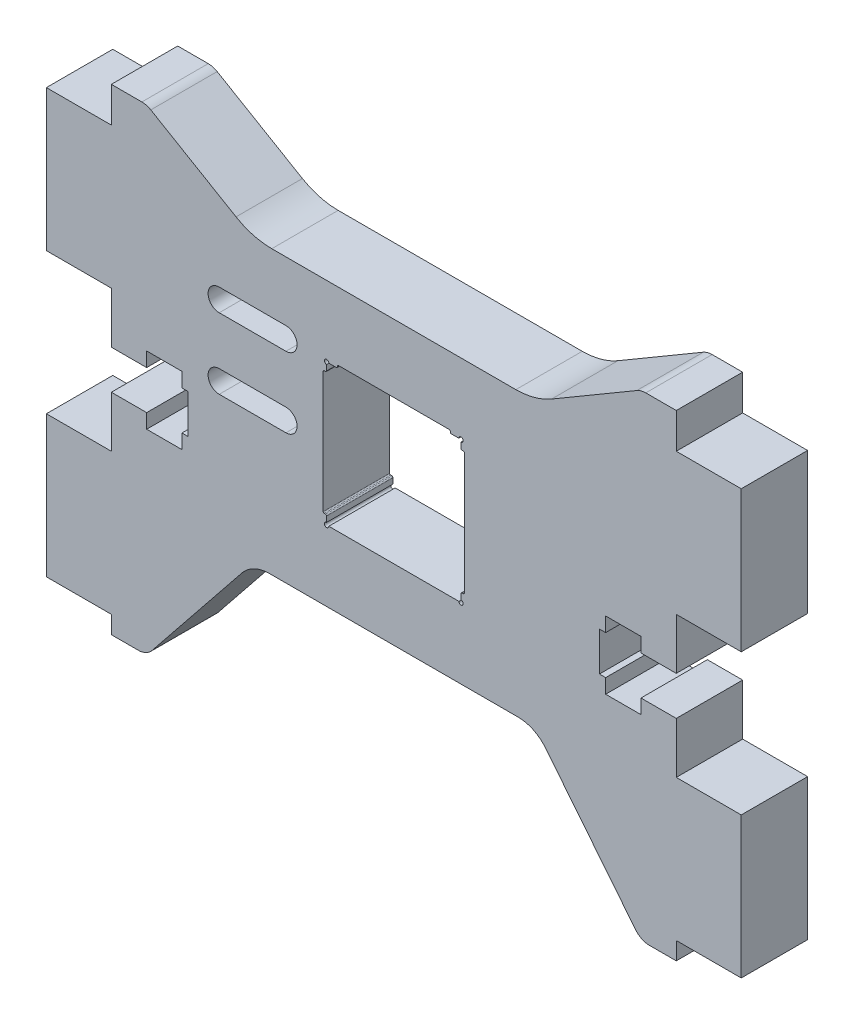
from build123d import *

# Parameters (mm, degrees)
SKETCH1_W           = 12.0904
SKETCH1_H           = 12.7
BOSS_EXTRUDE1_DEPTH = 5.969
CUT_EXTRUDE1_DEPTH  = 41.194496828
SKETCH3_R           = 0.1984375
CUT_EXTRUDE2_DEPTH  = 41.194496828
FILLET1_R           = 3.175
FILLET2_R           = 1.5875
SKETCH4_W           = 12.7
SKETCH4_H           = 11.1125
CUT_EXTRUDE3_DEPTH  = 41.194496828
FILLET7_R           = 0.1
SKETCH5_W           = 10.16
SKETCH5_H           = 0.5
CUT_EXTRUDE4_DEPTH  = 41.194496828
FILLET8_R           = 0.1
CUT_EXTRUDE5_DEPTH  = 41.194496828
FILLET9_R           = 6.35


with BuildPart() as part:
    # Sketch1 → Boss-Extrude1 (new body)
    with BuildSketch(Plane.XY):
        Polygon((25.4, 2.413), (25.4, -10.287), (31.242, -10.287), (31.242, -22.987), (25.4, -22.987), (25.4, -24.5745), (22.225, -24.5745), (12.7, -12.7), (-12.7, -12.7), (-22.225, -24.5745), (-25.4, -24.5745), (-25.4, -22.987), (-31.242, -22.987), (-31.242, -10.287), (-25.4, -10.287), (-25.4, 2.413), (-31.242, 2.413), (-31.242, 15.113), (-25.4, 15.113), (-25.4, 18.288), (-22.225, 18.288), (-12.7, 12.7), (12.7, 12.7), (22.225, 18.288), (25.4, 18.288), (25.4, 15.113), (31.242, 15.113), (31.242, 2.413), align=None)
        Rectangle(SKETCH1_W, SKETCH1_H, mode=Mode.SUBTRACT)
    extrude(amount=BOSS_EXTRUDE1_DEPTH)

    # Sketch2 → Cut-Extrude1 (cut, through all)
    with BuildSketch(Plane.XY.offset(5.969)):
        Polygon((22.225, -2.1844), (22.225, -0.889), (19.05, -0.889), (19.05, -2.1844), (18.492, -2.1844), (18.492, -5.6896), (19.05, -5.6896), (19.05, -6.985), (22.225, -6.985), (22.225, -5.6896), (25.4, -5.6896), (25.4, -2.1844), align=None)
        Polygon((-19.05, -2.1844), (-19.05, -0.889), (-22.225, -0.889), (-22.225, -2.1844), (-25.4, -2.1844), (-25.4, -5.6896), (-22.225, -5.6896), (-22.225, -6.985), (-19.05, -6.985), (-19.05, -5.6896), (-18.492, -5.6896), (-18.492, -2.1844), align=None)
    extrude(amount=-CUT_EXTRUDE1_DEPTH, mode=Mode.SUBTRACT)

    # Sketch3 → Cut-Extrude2 (cut, through all)
    with BuildSketch(Plane.XY.offset(5.969)):
        with Locations((6.0452, 6.35)):
            Circle(SKETCH3_R)
        with Locations((-6.0452, 6.35)):
            Circle(SKETCH3_R)
        with Locations((-6.0452, -6.35)):
            Circle(SKETCH3_R)
        with Locations((6.0452, -6.35)):
            Circle(SKETCH3_R)
    extrude(amount=-CUT_EXTRUDE2_DEPTH, mode=Mode.SUBTRACT)

    # Fillet1
    fillet1_edges = [part.edges().sort_by_distance(p)[0] for p in [
        (12.7, -12.7, 2.9845),
        (-12.7, -12.7, 2.9845),
    ]]
    fillet(fillet1_edges, radius=FILLET1_R)

    # Fillet2
    fillet2_edges = [part.edges().sort_by_distance(p)[0] for p in [
        (22.225, -24.5745, 2.9845),
        (-22.225, -24.5745, 2.9845),
        (-22.225, 18.288, 2.9845),
        (22.225, 18.288, 2.9845),
    ]]
    fillet(fillet2_edges, radius=FILLET2_R)

    # Sketch4 → Cut-Extrude3 (cut, through all)
    with BuildSketch(Plane.XY.offset(5.969)):
        Rectangle(SKETCH4_W, SKETCH4_H)
    extrude(amount=-CUT_EXTRUDE3_DEPTH, mode=Mode.SUBTRACT)

    # Fillet7
    fillet7_edges = [part.edges().sort_by_distance(p)[0] for p in [
        (6.0452, -5.55625, 2.9845),
        (6.0452, 5.55625, 2.9845),
        (-6.0452, 5.55625, 2.9845),
        (-6.35, 5.55625, 2.9845),
        (-6.0452, -5.55625, 2.9845),
        (-6.35, -5.55625, 2.9845),
        (6.35, 5.55625, 2.9845),
        (6.35, -5.55625, 2.9845),
    ]]
    fillet(fillet7_edges, radius=FILLET7_R)

    # Sketch5 → Cut-Extrude4 (cut, through all)
    with BuildSketch(Plane.XY.offset(5.969)):
        with Locations((0, 6.35)):
            Rectangle(SKETCH5_W, SKETCH5_H)
    extrude(amount=-CUT_EXTRUDE4_DEPTH, mode=Mode.SUBTRACT)

    # Fillet8
    fillet8_edges = [part.edges().sort_by_distance(p)[0] for p in [
        (5.08, 6.35, 2.9845),
        (-5.08, 6.35, 2.9845),
        (-5.08, 6.6, 2.9845),
        (5.08, 6.6, 2.9845),
    ]]
    fillet(fillet8_edges, radius=FILLET8_R)

    # Sketch6 → Cut-Extrude5 (cut, through all)
    with BuildSketch(Plane.XY.offset(5.969)):
        with BuildLine():
            Line((-15.7, 7.35), (-9.7, 7.35))
            ThreePointArc((-9.7, 7.35), (-8.7, 6.35), (-9.7, 5.35))
            Line((-9.7, 5.35), (-15.7, 5.35))
            ThreePointArc((-15.7, 5.35), (-16.7, 6.35), (-15.7, 7.35))
        make_face()
        with BuildLine():
            Line((-15.7, 1), (-9.7, 1))
            ThreePointArc((-9.7, 1), (-8.7, 0), (-9.7, -1))
            Line((-9.7, -1), (-15.7, -1))
            ThreePointArc((-15.7, -1), (-16.7, 0), (-15.7, 1))
        make_face()
    extrude(amount=-CUT_EXTRUDE5_DEPTH, mode=Mode.SUBTRACT)

    # Fillet9
    fillet9_edges = [part.edges().sort_by_distance(p)[0] for p in [
        (-12.7, 12.7, 2.9845),
        (12.7, 12.7, 2.9845),
    ]]
    fillet(fillet9_edges, radius=FILLET9_R)


solid = part.part
